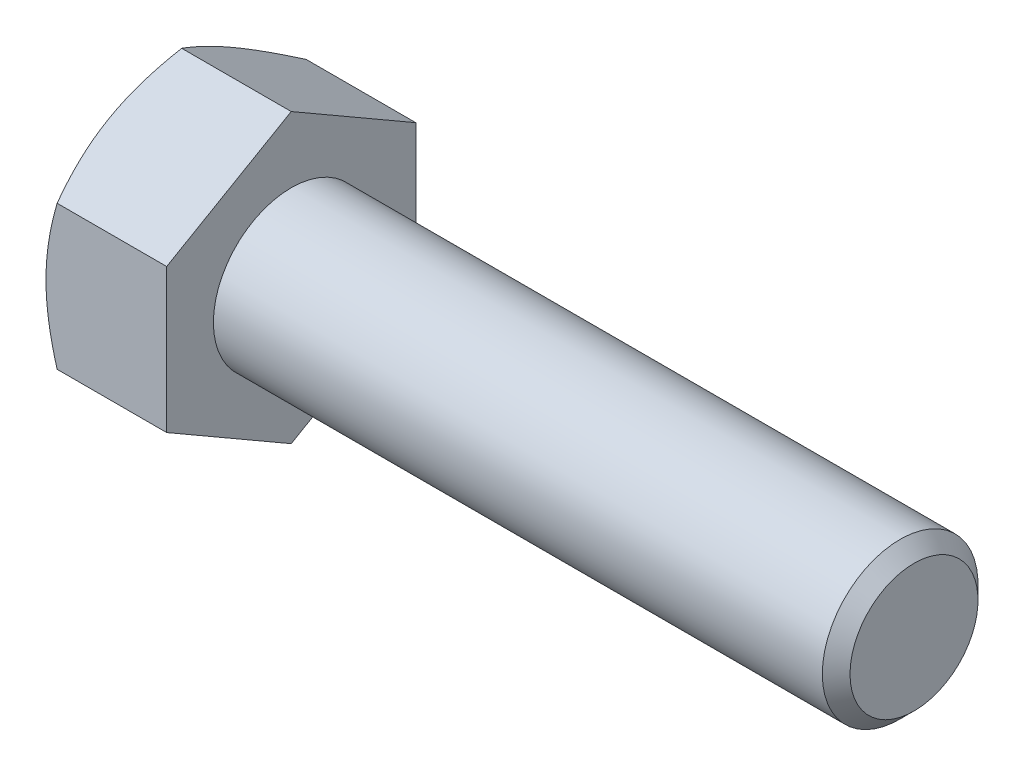
from build123d import *

# Parameters (mm, degrees)
BASEHEAD_DEPTH = 3.875


with BuildPart() as part:
    # Sketch1 → BaseHead (new body)
    with BuildSketch(Plane(origin=(0, 0, 0), x_dir=(0, 0, -1), z_dir=(1, 0, 0))):
        Polygon((4, 2.309401077), (4, -2.309401077), (0, -4.618802154), (-4, -2.309401077), (-4, 2.309401077), (0, 4.618802154), align=None)
    extrude(amount=BASEHEAD_DEPTH)

    # BodySke → BaseBody (revolve)
    with BuildSketch(Plane.XY, mode=Mode.PRIVATE) as basebody_sk:
        Polygon((0, 0), (23.875, 0), (23.875, 2.055), (23.43, 2.5), (0, 2.5), align=None)
    revolve(basebody_sk.sketch.rotate(Axis((0, 0, 0), (1, 0, 0)), 90), axis=Axis((0, 0, 0), (1, 0, 0)))

    # Sketch3 → HeadChamfer (revolve, cut)
    with BuildSketch(Plane.XY):
        Polygon((0, 4), (3.244016936, 9.618802154), (3.244016936, 14.618802154), (-10, 14.618802154), (-10, 4), align=None)
    revolve(axis=Axis((0, 0, 0), (1, 0, 0)), mode=Mode.SUBTRACT)


solid = part.part
